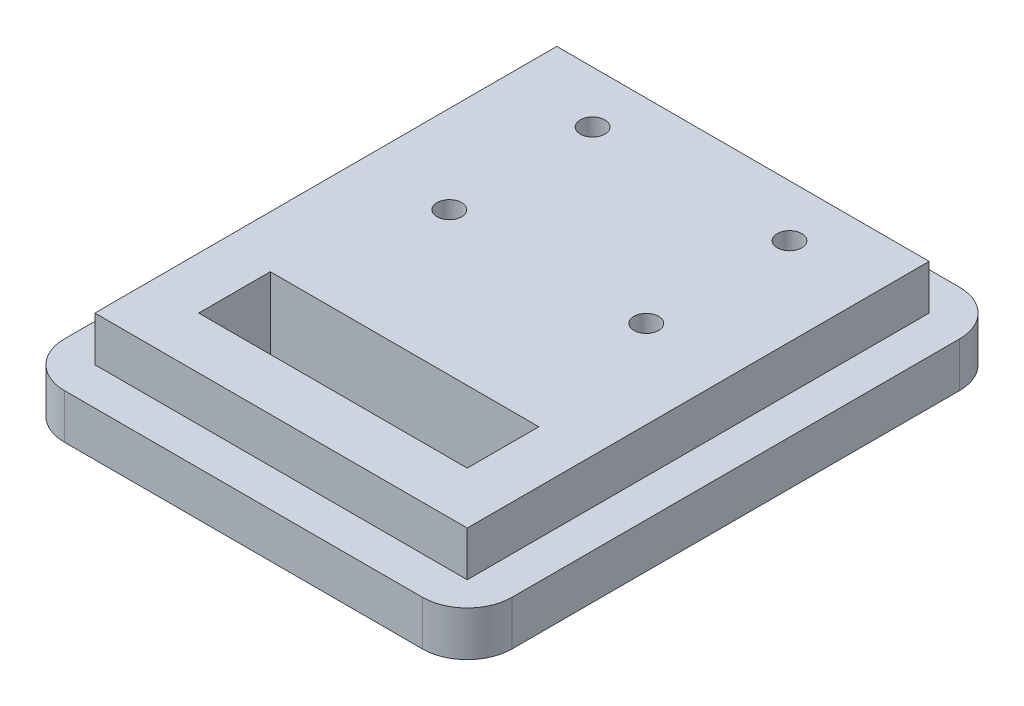
from build123d import *

# Parameters (mm, degrees)
SKETCH1_W           = 31.75
SKETCH1_H           = 38.1
BOSS_EXTRUDE1_DEPTH = 6.35
SKETCH2_R           = 0.875
CUT_EXTRUDE1_DEPTH  = 26.597668351
SKETCH3_W           = 19.05
SKETCH3_H           = 5.08
CUT_EXTRUDE2_DEPTH  = 26.597668351
SKETCH4_W           = 31.75
SKETCH4_H           = 38.1
SKETCH4_W_2         = 26.416
SKETCH4_H_2         = 32.766
CUT_EXTRUDE3_DEPTH  = 3.175
FILLET1_R           = 3.175


with BuildPart() as part:
    # Sketch1 → Boss-Extrude1 (new body)
    with BuildSketch(Plane(origin=(0, 0, 0), x_dir=(1, 0, 0), z_dir=(0, 1, 0))):
        Rectangle(SKETCH1_W, SKETCH1_H)
    extrude(amount=BOSS_EXTRUDE1_DEPTH)

    # Sketch2 → Cut-Extrude1 (cut, through all)
    with BuildSketch(Plane(origin=(0, 6.35, 0), x_dir=(1, 0, 0), z_dir=(0, 1, 0))):
        with Locations(Location((-6.985, 2.54, 0), (0, 0, 270))):
            Circle(SKETCH2_R)
        with Locations(Location((6.985, 2.54, 0), (0, 0, 270))):
            Circle(SKETCH2_R)
        with Locations(Location((-6.985, 12.7, 0), (0, 0, 270))):
            Circle(SKETCH2_R)
        with Locations(Location((6.985, 12.7, 0), (0, 0, 270))):
            Circle(SKETCH2_R)
    extrude(amount=-CUT_EXTRUDE1_DEPTH, mode=Mode.SUBTRACT)

    # Sketch3 → Cut-Extrude2 (cut, through all)
    with BuildSketch(Plane(origin=(0, 6.35, 0), x_dir=(1, 0, 0), z_dir=(0, 1, 0))):
        with Locations((0, -10.16)):
            Rectangle(SKETCH3_W, SKETCH3_H)
    extrude(amount=-CUT_EXTRUDE2_DEPTH, mode=Mode.SUBTRACT)

    # Sketch4 → Cut-Extrude3 (cut)
    with BuildSketch(Plane(origin=(0, 6.35, 0), x_dir=(1, 0, 0), z_dir=(0, 1, 0))):
        Rectangle(SKETCH4_W, SKETCH4_H)
        Rectangle(SKETCH4_W_2, SKETCH4_H_2, mode=Mode.SUBTRACT)
    extrude(amount=-CUT_EXTRUDE3_DEPTH, mode=Mode.SUBTRACT)

    # Fillet1
    fillet1_edges = [part.edges().sort_by_distance(p)[0] for p in [
        (15.875, 1.5875, 19.05),
        (-15.875, 1.5875, 19.05),
        (-15.875, 1.5875, -19.05),
        (15.875, 1.5875, -19.05),
    ]]
    fillet(fillet1_edges, radius=FILLET1_R)


solid = part.part
